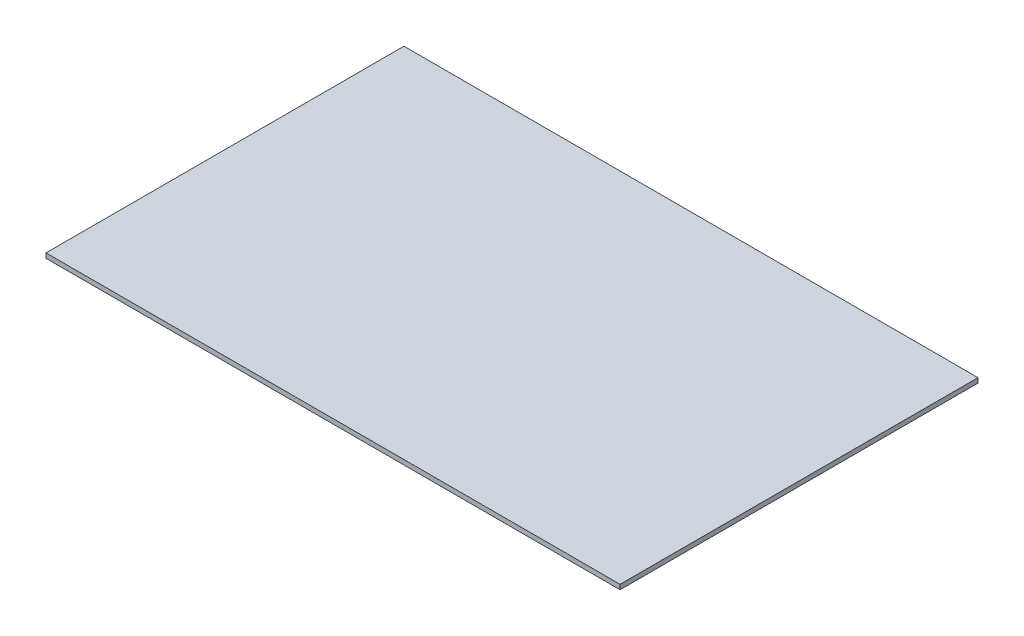
from build123d import *

# Parameters (mm, degrees)
IZIM3_W                     = 85
IZIM3_H                     = 53
Y_KSEKLIK_EKSTR_ZYON1_DEPTH = 0.7


with BuildPart() as part:
    # Çizim3 → Yükseklik-Ekstrüzyon1 (new body)
    with BuildSketch(Plane(origin=(0, 0, 0), x_dir=(1, 0, 0), z_dir=(0, 1, 0))):
        with Locations((-3.930447774, 1.666666667)):
            Rectangle(IZIM3_W, IZIM3_H)
    extrude(amount=Y_KSEKLIK_EKSTR_ZYON1_DEPTH)


solid = part.part
